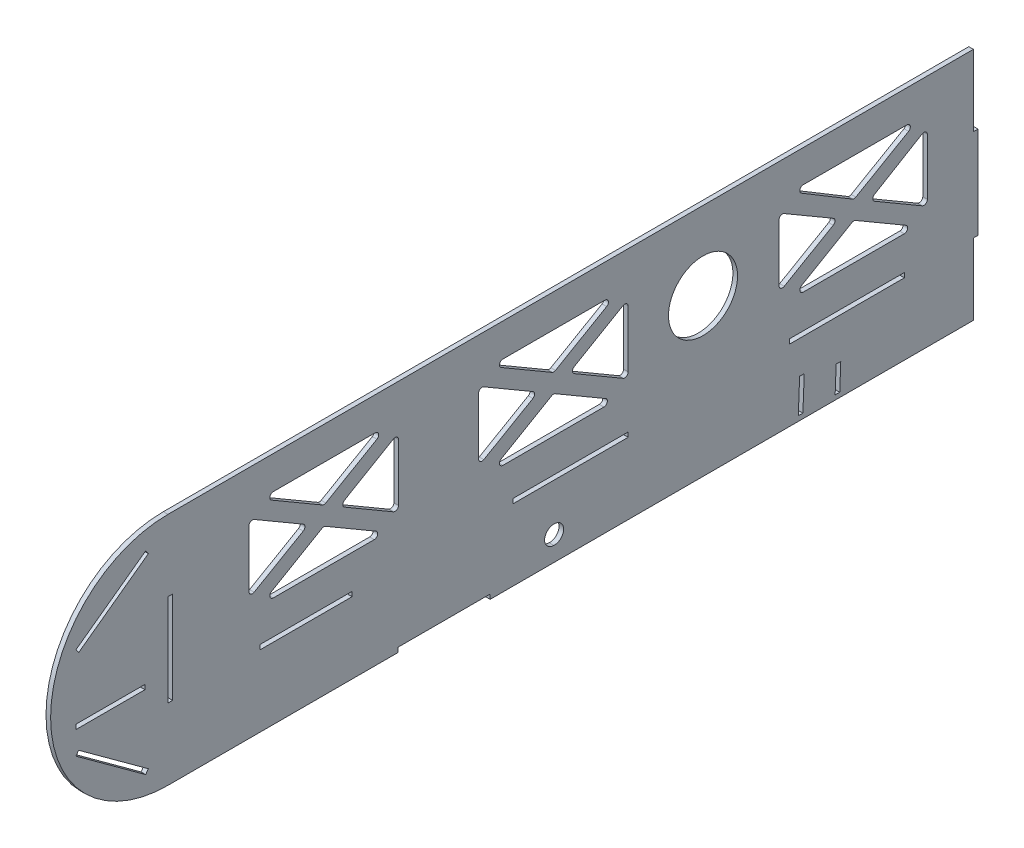
from build123d import *

# Parameters (mm, degrees)
SKETCH_1_W          = 40
SKETCH_1_H          = 2
SKETCH_1_W_2        = 50
SKETCH_1_R          = 15
SKETCH_1_W_3        = 30
SKETCH_1_W_4        = 2
SKETCH_1_H_2        = 40
EXTRUDE_3_DEPTH     = 2
SKETCH_2_W          = 190.078492772
SKETCH_2_H          = 26.673691145
EXTRUDE_4_DEPTH     = 2
CUT_EXTRUDE_1_DEPTH = 2
CUT_EXTRUDE_2_DEPTH = 2


with BuildPart() as part:
    # 草图1 → 凸台-拉伸3 (new body)
    # profile 1 of 4: a face of its own
    with BuildSketch(Plane(origin=(0, 0, 0), x_dir=(0, 0, -1), z_dir=(1, 0, 0))):
        Polygon((139, 51), (0, 51), (0, 20), (2, 20), (2, -20), (0, -20), (0, -51), (100, -51), (100, -49), (140, -49), (140, -51), (350, -51), (350, -20), (350, 20), (350, 51), (337.5, 51), (331.5, 51), (145, 51), align=None)
        with Locations((59.999999544, -18.999999639)):
            Rectangle(SKETCH_1_W, SKETCH_1_H, mode=Mode.SUBTRACT)
        with BuildLine():
            Line((145, -43), (145, -32))
            ThreePointArc((145, -32), (146.757359313, -27.757359313), (151, -26))
            Line((151, -26), (235, -26))
            Line((235, -26), (305, -26))
            Line((305, -26), (325.5, -26))
            ThreePointArc((325.5, -26), (329.742640687, -27.757359313), (331.5, -32))
            Line((331.5, -32), (331.5, -35))
            Line((331.5, -35), (331.5, -43))
            ThreePointArc((331.5, -43), (329.742640687, -47.242640687), (325.5, -49))
            Line((325.5, -49), (151, -49))
            ThreePointArc((151, -49), (146.757359313, -47.242640687), (145, -43))
        make_face(mode=Mode.SUBTRACT)
        with Locations((174.999999544, -18.999999639)):
            Rectangle(SKETCH_1_W_2, SKETCH_1_H, mode=Mode.SUBTRACT)
        with Locations((294.999999544, -18.999999639)):
            Rectangle(SKETCH_1_W_2, SKETCH_1_H, mode=Mode.SUBTRACT)
        with BuildLine():
            Line((35.191745107, 4.260800891), (35.191745107, 29.047933032))
            ThreePointArc((35.191745107, 29.047933032), (35.944654017, 30.348646261), (37.447551645, 30.343601384))
            Line((37.447551645, 30.343601384), (58.776761499, 17.901562302))
            ThreePointArc((58.776761499, 17.901562302), (59.520952796, 16.603345479), (58.772354511, 15.307664881))
            Line((58.772354511, 15.307664881), (37.443144656, 2.962571821))
            ThreePointArc((37.443144656, 2.962571821), (35.942445208, 2.961358833), (35.191745107, 4.260800891))
        make_face(mode=Mode.SUBTRACT)
        with BuildLine():
            Line((89.643364252, -3.340511469), (45.740125962, -3.340511469))
            ThreePointArc((45.740125962, -3.340511469), (44.292109641, -2.231981438), (44.984319423, -0.544843118))
            Line((44.984319423, -0.544843118), (66.935938568, 12.26026805))
            ThreePointArc((66.935938568, 12.26026805), (67.691745107, 12.464599699), (68.447551645, 12.26026805))
            Line((68.447551645, 12.26026805), (90.39917079, -0.544843118))
            ThreePointArc((90.39917079, -0.544843118), (91.091380572, -2.231981438), (89.643364252, -3.340511469))
        make_face(mode=Mode.SUBTRACT)
        with BuildLine():
            ThreePointArc((97.935938568, 30.343601384), (99.438836196, 30.348646261), (100.191745107, 29.047933032))
            Line((100.191745107, 29.047933032), (100.191745107, 4.27104403))
            ThreePointArc((100.191745107, 4.27104403), (99.438836196, 2.970330801), (97.935938568, 2.975375678))
            Line((97.935938568, 2.975375678), (76.698605138, 15.36382018))
            ThreePointArc((76.698605138, 15.36382018), (75.954411676, 16.659488531), (76.698605138, 17.955156882))
            Line((76.698605138, 17.955156882), (97.935938568, 30.343601384))
        make_face(mode=Mode.SUBTRACT)
        with BuildLine():
            Line((134.999999544, 4.260800891), (134.999999544, 29.047933032))
            ThreePointArc((134.999999544, 29.047933032), (135.752908454, 30.348646261), (137.255806082, 30.343601384))
            Line((137.255806082, 30.343601384), (158.585015936, 17.901562302))
            ThreePointArc((158.585015936, 17.901562302), (159.329207233, 16.603345479), (158.580608948, 15.307664881))
            Line((158.580608948, 15.307664881), (137.251399093, 2.962571821))
            ThreePointArc((137.251399093, 2.962571821), (135.750699645, 2.961358833), (134.999999544, 4.260800891))
        make_face(mode=Mode.SUBTRACT)
        with BuildLine():
            ThreePointArc((44.984319423, 33.86382018), (44.292109641, 35.5509585), (45.740125962, 36.659488531))
            Line((45.740125962, 36.659488531), (90.076890905, 36.659488531))
            ThreePointArc((90.076890905, 36.659488531), (91.525570236, 35.548497783), (90.828290455, 33.861259462))
            Line((90.828290455, 33.861259462), (68.573204266, 20.980280188))
            ThreePointArc((68.573204266, 20.980280188), (67.819256245, 20.778511422), (67.065998178, 20.982840906))
            Line((67.065998178, 20.982840906), (44.984319423, 33.86382018))
        make_face(mode=Mode.SUBTRACT)
        with BuildLine():
            Line((189.451618689, -3.340511469), (145.548380399, -3.340511469))
            ThreePointArc((145.548380399, -3.340511469), (144.100364078, -2.231981438), (144.79257386, -0.544843118))
            Line((144.79257386, -0.544843118), (166.744193005, 12.26026805))
            ThreePointArc((166.744193005, 12.26026805), (167.499999544, 12.464599699), (168.255806082, 12.26026805))
            Line((168.255806082, 12.26026805), (190.207425227, -0.544843118))
            ThreePointArc((190.207425227, -0.544843118), (190.899635009, -2.231981438), (189.451618689, -3.340511469))
        make_face(mode=Mode.SUBTRACT)
        with BuildLine():
            ThreePointArc((197.744193005, 30.684113214), (199.247090633, 30.689158091), (199.999999544, 29.388444862))
            Line((199.999999544, 29.388444862), (199.999999544, 4.61155586))
            ThreePointArc((199.999999544, 4.61155586), (199.247090633, 3.310842631), (197.744193005, 3.315887508))
            Line((197.744193005, 3.315887508), (176.506859575, 15.70433201))
            ThreePointArc((176.506859575, 15.70433201), (175.762666113, 17.000000361), (176.506859575, 18.295668712))
            Line((176.506859575, 18.295668712), (197.744193005, 30.684113214))
        make_face(mode=Mode.SUBTRACT)
        with Locations((232.499999544, 17.000000361)):
            Circle(SKETCH_1_R, mode=Mode.SUBTRACT)
        with BuildLine():
            Line((319.974166341, -3.394327578), (276.070928051, -3.394327578))
            ThreePointArc((276.070928051, -3.394327578), (274.622911731, -2.285797546), (275.315121513, -0.598659226))
            Line((275.315121513, -0.598659226), (297.266740658, 12.206451942))
            ThreePointArc((297.266740658, 12.206451942), (298.022547196, 12.41078359), (298.778353734, 12.206451942))
            Line((298.778353734, 12.206451942), (320.729972879, -0.598659226))
            ThreePointArc((320.729972879, -0.598659226), (321.422182661, -2.285797546), (319.974166341, -3.394327578))
        make_face(mode=Mode.SUBTRACT)
        with BuildLine():
            Line((265.522547196, 4.206984782), (265.522547196, 28.994116924))
            ThreePointArc((265.522547196, 28.994116924), (266.275456106, 30.294830153), (267.778353734, 30.289785275))
            Line((267.778353734, 30.289785275), (289.107563589, 17.847746193))
            ThreePointArc((289.107563589, 17.847746193), (289.851754885, 16.549529371), (289.1031566, 15.253848773))
            Line((289.1031566, 15.253848773), (267.773946745, 2.908755713))
            ThreePointArc((267.773946745, 2.908755713), (266.273247297, 2.907542724), (265.522547196, 4.206984782))
        make_face(mode=Mode.SUBTRACT)
        with BuildLine():
            ThreePointArc((327.730104048, 30.281463391), (329.239984934, 30.298885724), (329.999999544, 28.994116924))
            Line((329.999999544, 28.994116924), (329.999999544, 4.522047385))
            ThreePointArc((329.999999544, 4.522047385), (329.247090633, 3.221334156), (327.744193005, 3.226379034))
            Line((327.744193005, 3.226379034), (307.029407227, 15.310004071))
            ThreePointArc((307.029407227, 15.310004071), (306.285236078, 16.597490851), (307.01531827, 17.893018889))
            Line((307.01531827, 17.893018889), (327.730104048, 30.281463391))
        make_face(mode=Mode.SUBTRACT)
        with BuildLine():
            ThreePointArc((144.79257386, 33.86382018), (144.100364078, 35.5509585), (145.548380399, 36.659488531))
            Line((145.548380399, 36.659488531), (189.885145343, 36.659488531))
            ThreePointArc((189.885145343, 36.659488531), (191.333824673, 35.548497783), (190.636544892, 33.861259462))
            Line((190.636544892, 33.861259462), (168.381458703, 20.980280188))
            ThreePointArc((168.381458703, 20.980280188), (167.627510682, 20.778511422), (166.874252615, 20.982840906))
            Line((166.874252615, 20.982840906), (144.79257386, 33.86382018))
        make_face(mode=Mode.SUBTRACT)
        with BuildLine():
            ThreePointArc((275.298058871, 34.214436971), (274.625531032, 35.901033349), (276.070928051, 37.000000361))
            Line((276.070928051, 37.000000361), (321.088992302, 37.000000361))
            ThreePointArc((321.088992302, 37.000000361), (322.537671633, 35.889009613), (321.840391852, 34.201771291))
            Line((321.840391852, 34.201771291), (298.904006355, 20.926464079))
            ThreePointArc((298.904006355, 20.926464079), (298.140143214, 20.72474493), (297.379737626, 20.939129758))
            Line((297.379737626, 20.939129758), (275.298058871, 34.214436971))
        make_face(mode=Mode.SUBTRACT)
    # profile 2 of 4: a face of its own
    with BuildSketch(Plane(origin=(0, 0, 0), x_dir=(0, 0, -1), z_dir=(1, 0, 0))):
        with BuildLine():
            Line((0, 20), (0, 51))
            ThreePointArc((0, 51), (-36.062445841, 36.062445841), (-51, 0))
            Line((-51, 0), (0, 0))
            Line((0, 0), (0, 20))
        make_face()
        Polygon((-38.821768829, 18.383902445), (-40, 20), (-9.698170842, 42.091834457), (-8.519939671, 40.475736902), align=None, mode=Mode.SUBTRACT)
    # profile 3 of 4: a face of its own
    with BuildSketch(Plane(origin=(0, 0, 0), x_dir=(0, 0, -1), z_dir=(1, 0, 0))):
        with BuildLine():
            Line((0, 0), (-51, 0))
            ThreePointArc((-51, 0), (-36.062445841, -36.062445841), (0, -51))
            Line((0, -51), (0, -20))
            Line((0, -20), (0, 0))
        make_face()
        Polygon((-40, -20), (-38.821768829, -18.383902445), (-8.519939671, -40.475736902), (-9.698170842, -42.091834457), align=None, mode=Mode.SUBTRACT)
        with Locations((-25, -9)):
            Rectangle(SKETCH_1_W_3, SKETCH_1_H, mode=Mode.SUBTRACT)
    # profile 4 of 4: a face of its own
    with BuildSketch(Plane(origin=(0, 0, 0), x_dir=(0, 0, -1), z_dir=(1, 0, 0))):
        with Locations((351, 0)):
            Rectangle(SKETCH_1_W_4, SKETCH_1_H_2)
    extrude(amount=EXTRUDE_3_DEPTH)

    # 草图2 → 凸台-拉伸4 (add)
    with BuildSketch(Plane(origin=(2, 0, 0), x_dir=(0, 0, -1), z_dir=(1, 0, 0))):
        with Locations((237.791738903, -36.733598544)):
            Rectangle(SKETCH_2_W, SKETCH_2_H)
    extrude(amount=-EXTRUDE_4_DEPTH)

    # 草图3 → 切除-拉伸1 (cut)
    with BuildSketch(Plane.ZY):
        Polygon((-276.474715487, -34.635525304), (-276.486854743, -34.329149941), (-274.488422813, -34.249967741), (-273.909339591, -48.865100933), (-275.910680122, -48.870874702), align=None)
        Polygon((-291.918118303, -49), (-292.352577698, -38.034940321), (-292.366784403, -37.676385824), (-290.368352473, -37.597203626), (-289.916778482, -48.994208323), align=None)
    extrude(amount=-CUT_EXTRUDE_1_DEPTH, mode=Mode.SUBTRACT)

    # 草图4 → 切除-拉伸2 (cut)
    with BuildSketch(Plane(origin=(2, 0, 0), x_dir=(0, 0, -1), z_dir=(1, 0, 0))):
        with BuildLine():
            ThreePointArc((167.635934129, -44.518280263), (171.92449544, -40.687294754), (167.952486385, -36.529007588))
            ThreePointArc((167.952486385, -36.529007588), (163.663925074, -40.359993097), (167.635934129, -44.518280263))
        make_face()
    extrude(amount=-CUT_EXTRUDE_2_DEPTH, mode=Mode.SUBTRACT)


solid = part.part
